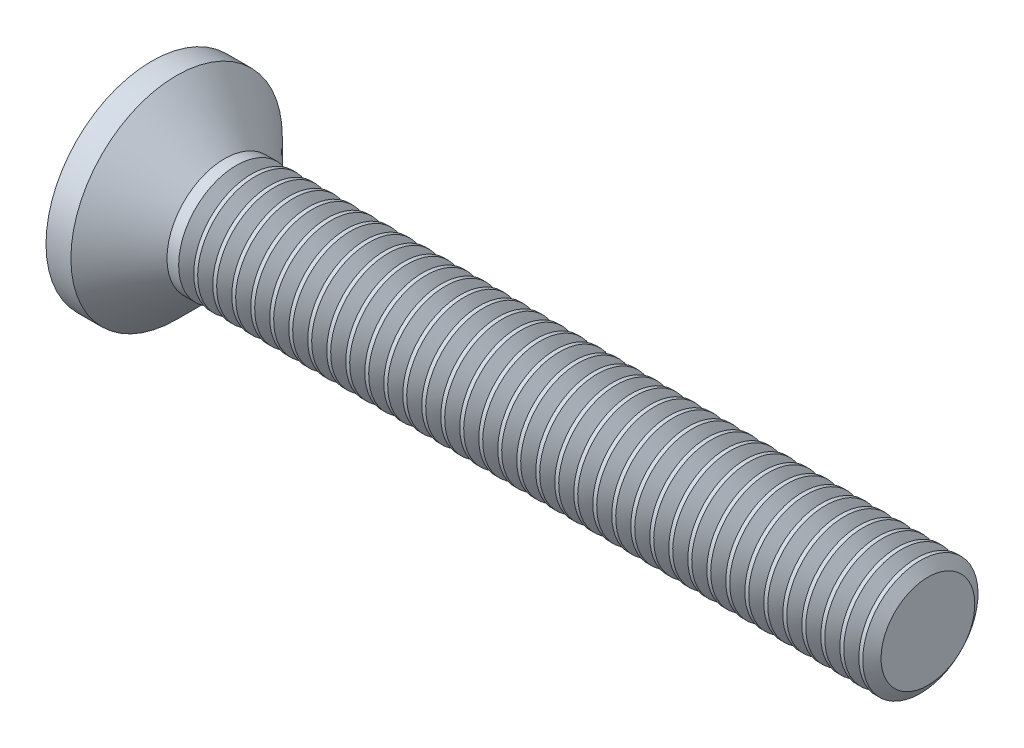
from build123d import *

# Parameters (mm, degrees)
CIRPATTERN1_COUNT = 2
CIRPATTERN1_ANGLE = 90
THDSCHPAT_COUNT   = 37
THDSCHPAT_PITCH   = 0.494444444


with BuildPart() as part:
    # BodySke → Base-Revolve (revolve)
    with BuildSketch(Plane.XY, mode=Mode.PRIVATE) as base_revolve_sk:
        with BuildLine():
            Line((0, 0), (20.727669073, 0))
            Line((20.727669073, 0), (20.727669073, 1.5))
            Line((20.727669073, 1.5), (2.427669073, 1.5))
            Line((2.427669073, 1.5), (1.177669073, 2.75))
            Line((1.177669073, 2.75), (0.529956332, 2.75))
            ThreePointArc((0.529956332, 2.75), (0.133696843, 1.400299407), (0, 0))
        make_face()
    revolve(base_revolve_sk.sketch.rotate(Axis((-15.875, 0, 0), (1, 0, 0)), 90), axis=Axis((-15.875, 0, 0), (1, 0, 0)))

    # Sketch3 → Cross section 0
    with BuildSketch(Plane(origin=(0, 0, 0), x_dir=(0, 0, -1), z_dir=(1, 0, 0))):
        with BuildLine():
            Line((0.415, -1.72), (-0.415, -1.72))
            Line((-0.415, -1.72), (-0.415, 1.72))
            Line((-0.415, 1.72), (0.415, 1.72))
            Line((0.415, 1.72), (0.415, -1.72))
        make_face()
    # Sketch4 → Cross section 1
    with BuildSketch(Plane(origin=(2.33, 0, 0), x_dir=(0, 0, -1), z_dir=(1, 0, 0))):
        with BuildLine():
            Line((0.2075, -0.2075), (-0.2075, -0.2075))
            Line((-0.2075, -0.2075), (-0.2075, 0.2075))
            Line((-0.2075, 0.2075), (0.2075, 0.2075))
            Line((0.2075, 0.2075), (0.2075, -0.2075))
        make_face()
    cross = loft(mode=Mode.SUBTRACT)

    # CirPattern1: Cross ×2 about axis
    cirpattern1_axis = Axis((0, 0, 0), (1, 0, 0))
    for i in range(1, CIRPATTERN1_COUNT):
        add(cross.rotate(cirpattern1_axis, i * CIRPATTERN1_ANGLE / (CIRPATTERN1_COUNT - 1)), mode=Mode.SUBTRACT)

    # ThdSchSke → ThreadSchematic (revolve, cut)
    with BuildSketch(Plane.XY):
        Polygon((2.927669073, -1.2195), (2.731260858, -1.5), (2.731260858, -1.875), (3.124077287, -1.875), (3.124077287, -1.5), align=None)
    threadschematic = revolve(axis=Axis((-3.175, 0, 0), (1, 0, 0)), mode=Mode.SUBTRACT)

    # ThdSchPat: ThreadSchematic ×37
    with Locations(*[(i * THDSCHPAT_PITCH, 0, 0) for i in range(1, THDSCHPAT_COUNT)]):
        add(threadschematic, mode=Mode.SUBTRACT)


solid = part.part
